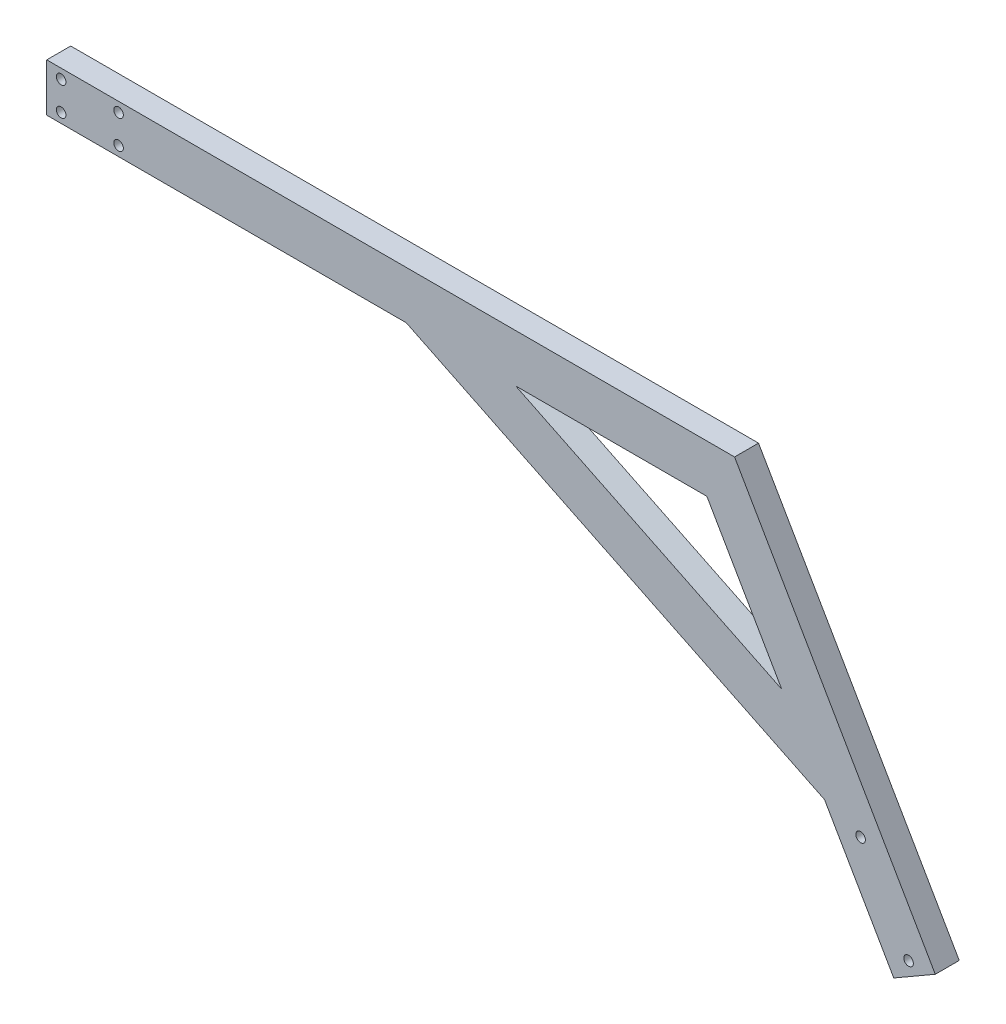
from build123d import *

# Parameters (mm, degrees)
SKETCH1_R           = 2
BOSS_EXTRUDE1_DEPTH = 10
BOSS_EXTRUDE2_DEPTH = 10


with BuildPart() as part:
    # Sketch1 → Boss-Extrude1 (new body)
    with BuildSketch(Plane.XY):
        Polygon((0, 0), (275.4, 0), (353.366040361, -135.04114317), (370.686548437, -125.04114317), (286.947005384, 20), (0, 20), align=None)
        with Locations((6, 15.98)):
            Circle(SKETCH1_R, mode=Mode.SUBTRACT)
        with Locations((29.96, 15.98)):
            Circle(SKETCH1_R, mode=Mode.SUBTRACT)
        with Locations((29.96, 4.02)):
            Circle(SKETCH1_R, mode=Mode.SUBTRACT)
        with Locations((6, 4.02)):
            Circle(SKETCH1_R, mode=Mode.SUBTRACT)
        with Locations((339.526294399, -91.07)):
            Circle(SKETCH1_R, mode=Mode.SUBTRACT)
        with Locations((359.526294399, -125.711016151)):
            Circle(SKETCH1_R, mode=Mode.SUBTRACT)
    extrude(amount=BOSS_EXTRUDE1_DEPTH)

    # Sketch2 → Boss-Extrude2 (add)
    with BuildSketch(Plane.XY):
        Polygon((150, 0), (324.498526902, -85.04114317), (306.623888719, -54.081361672), (195.652685926, 0), align=None)
    extrude(amount=BOSS_EXTRUDE2_DEPTH)


solid = part.part
